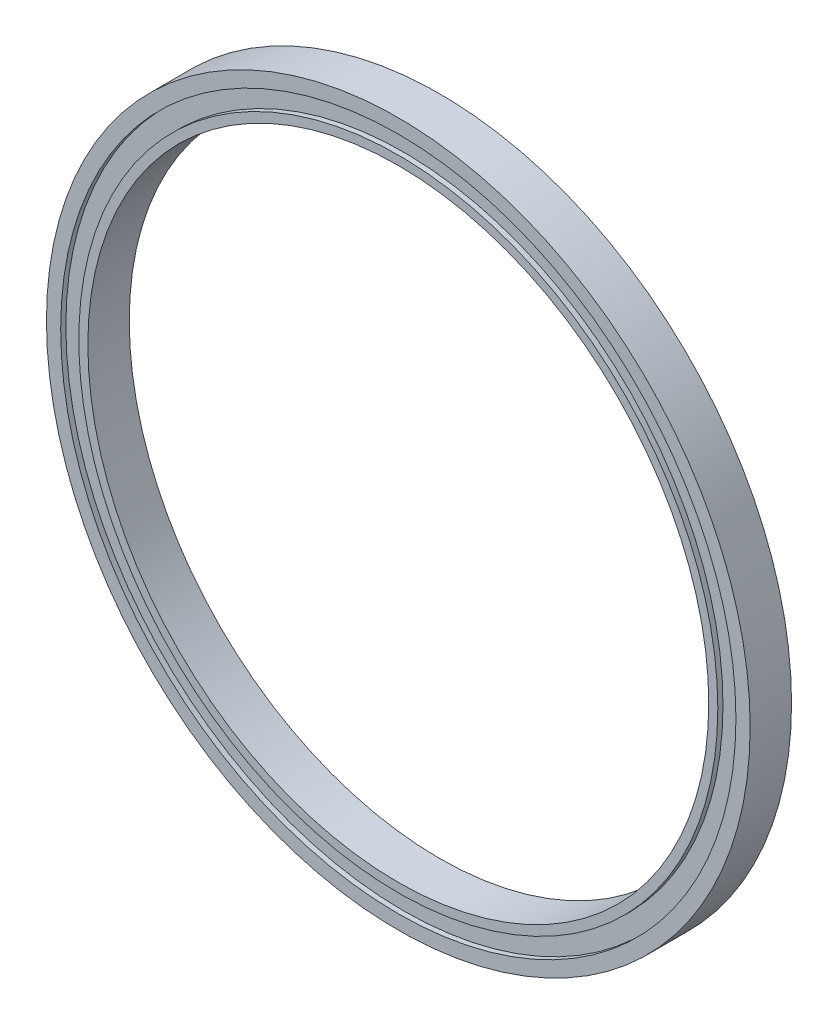
from build123d import *

# Parameters (mm, degrees)
SKETCH_1_R          = 68
SKETCH_1_R_2        = 60
EXTRUDE_1_DEPTH     = 8
SKETCH_2_R          = 65.25
SKETCH_2_R_2        = 61.75
CUT_EXTRUDE_1_DEPTH = 1
CUT_EXTRUDE_START   = -1
SKETCH_3_R          = 65.25
SKETCH_3_R_2        = 61.75
CUT_EXTRUDE_2_DEPTH = 1


with BuildPart() as part:
    # 草图1 → 凸台-拉伸1 (new body)
    with BuildSketch(Plane.XY):
        Circle(SKETCH_1_R)
        Circle(SKETCH_1_R_2, mode=Mode.SUBTRACT)
    extrude(amount=EXTRUDE_1_DEPTH)

    # 草图2 → 切除-拉伸1 (cut)
    with BuildSketch(Plane.XY.offset(8)):
        Circle(SKETCH_2_R)
        Circle(SKETCH_2_R_2, mode=Mode.SUBTRACT)
    extrude(amount=-CUT_EXTRUDE_1_DEPTH, mode=Mode.SUBTRACT)

    # 草图3 → 切除-拉伸2 (cut)
    with BuildSketch(Plane(origin=(0, 0, 0), x_dir=(-1, 0, 0), z_dir=(0, 0, -1)).offset(CUT_EXTRUDE_START)):
        with Locations(Location((0, 0, 0), (0, 0, 180))):
            Circle(SKETCH_3_R)
        with Locations(Location((0, 0, 0), (0, 0, 180))):
            Circle(SKETCH_3_R_2, mode=Mode.SUBTRACT)
    extrude(amount=CUT_EXTRUDE_2_DEPTH, mode=Mode.SUBTRACT)


solid = part.part
